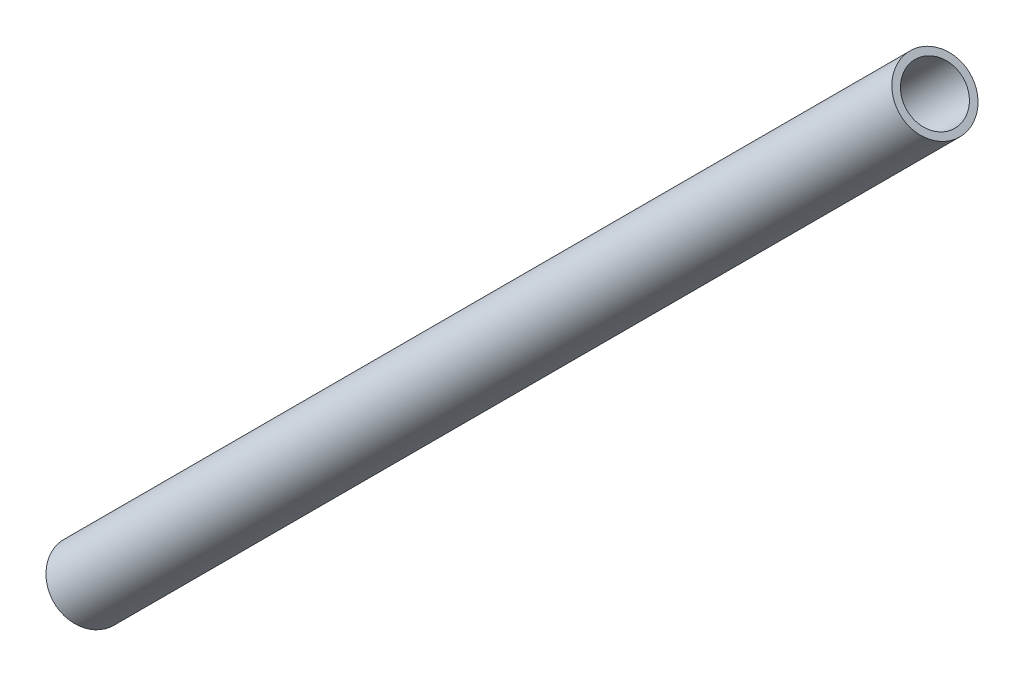
from build123d import *

# Parameters (mm, degrees)
SKETCH2_R           = 5
SKETCH2_R_2         = 4
BOSS_EXTRUDE1_DEPTH = 170


with BuildPart() as part:
    # Sketch2 → Boss-Extrude1 (new body)
    with BuildSketch(Plane(origin=(94.859307055, 94.859307055, 0), x_dir=(0, 0, 1), z_dir=(-0.707106781186544, -0.7071067811865511, 0))):
        with Locations(Location((-10, -38.456734122, 0), (0, 0, 270))):
            Circle(SKETCH2_R)
        with Locations(Location((-10, -38.456734122, 0), (0, 0, 270))):
            Circle(SKETCH2_R_2, mode=Mode.SUBTRACT)
    extrude(amount=BOSS_EXTRUDE1_DEPTH)


solid = part.part
